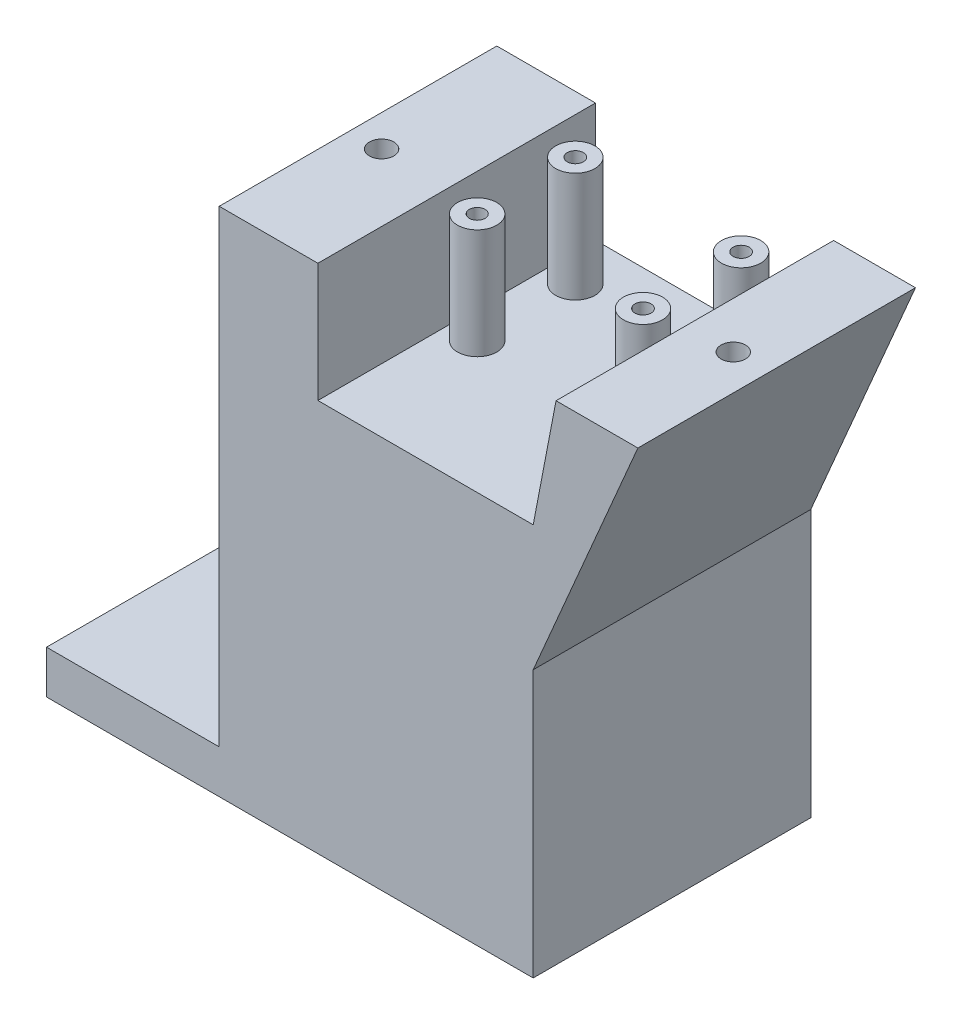
from build123d import *

# Parameters (mm, degrees)
SKETCH1_W              = 40
SKETCH1_H              = 35.362964007
BOSS_EXTRUDE1_DEPTH    = 50
SKETCH2_W              = 35.362964007
SKETCH2_H              = 5.5
BOSS_EXTRUDE2_DEPTH    = 22
SKETCH3_R              = 2.5
SKETCH3_R_2            = 1
SKETCH3_R_3            = 1.025
BOSS_EXTRUDE3_DEPTH    = 14
D_GAGEMENT_M71_D       = 8
BOSS_EXTRUDE4_DEPTH    = 35.362964
SKETCH8_W              = 12.572018863
SKETCH8_H              = 35.362964007
BOSS_EXTRUDE5_DEPTH    = 15.144107649
D_GAGEMENT_M2_53_D     = 3.1
D_GAGEMENT_M2_53_DEPTH = 6
D_GAGEMENT_M2_53_TIP   = 0.931333959
D_GAGEMENT_M2_51_D     = 3.1
D_GAGEMENT_M2_51_DEPTH = 6
D_GAGEMENT_M2_51_TIP   = 0.931333959


with BuildPart() as part:
    # Sketch1 → Boss-Extrude1 (new body)
    with BuildSketch(Plane(origin=(0, 0, 0), x_dir=(1, 0, 0), z_dir=(0, 1, 0))):
        with Locations((7.230679314, -2.945715381)):
            Rectangle(SKETCH1_W, SKETCH1_H)
    extrude(amount=BOSS_EXTRUDE1_DEPTH)

    # Sketch2 → Boss-Extrude2 (add)
    with BuildSketch(Plane.ZY.offset(12.769320686)):
        with Locations((2.945715381, 2.75)):
            Rectangle(SKETCH2_W, SKETCH2_H)
    extrude(amount=BOSS_EXTRUDE2_DEPTH)

    # Sketch3 → Boss-Extrude3 (add)
    # profile 1 of 4: a face of its own
    with BuildSketch(Plane(origin=(0, 50, 0), x_dir=(1, 0, 0), z_dir=(0, 1, 0))):
        with Locations(Location((3.355679314, -3.889233377, 0), (0, 0, 90))):
            Circle(SKETCH3_R)
        with Locations(Location((3.355679314, -3.889233377, 0), (0, 0, 270))):
            Circle(SKETCH3_R_2, mode=Mode.SUBTRACT)
    # profile 2 of 4: a face of its own
    with BuildSketch(Plane(origin=(0, 50, 0), x_dir=(1, 0, 0), z_dir=(0, 1, 0))):
        with Locations(Location((24.355679314, -3.764233372, 0), (0, 0, 90))):
            Circle(SKETCH3_R)
        with Locations(Location((24.355679314, -3.764233372, 0), (0, 0, 270))):
            Circle(SKETCH3_R_3, mode=Mode.SUBTRACT)
    # profile 3 of 4: a face of its own
    with BuildSketch(Plane(origin=(0, 50, 0), x_dir=(1, 0, 0), z_dir=(0, 1, 0))):
        with Locations(Location((3.355679314, 8.610766623, 0), (0, 0, 90))):
            Circle(SKETCH3_R)
        with Locations(Location((3.355679314, 8.610766623, 0), (0, 0, 270))):
            Circle(SKETCH3_R_3, mode=Mode.SUBTRACT)
    # profile 4 of 4: a face of its own
    with BuildSketch(Plane(origin=(0, 50, 0), x_dir=(1, 0, 0), z_dir=(0, 1, 0))):
        with Locations(Location((24.355307287, 8.735766623, 0), (0, 0, 90))):
            Circle(SKETCH3_R)
        with Locations(Location((24.355307287, 8.735766623, 0), (0, 0, 270))):
            Circle(SKETCH3_R_3, mode=Mode.SUBTRACT)
    extrude(amount=BOSS_EXTRUDE3_DEPTH)

    # Dégagement M71 (through all)
    with Locations(Plane(origin=(0, 0, 0), x_dir=(-1, 0, 0), z_dir=(0, -1, 0))):
        with Locations((24.769320686, -2.945715381)):
            Hole(D_GAGEMENT_M71_D / 2)

    # Sketch7 → Boss-Extrude4 (add)
    with BuildSketch(Plane.XY.offset(20.627197384)):
        Polygon((27.230679314, 34.010518151), (40.568594836, 65.144107649), (30.139889808, 65.144107649), (27.230679314, 50), align=None)
    extrude(amount=-BOSS_EXTRUDE4_DEPTH)

    # Sketch8 → Boss-Extrude5 (add)
    with BuildSketch(Plane(origin=(0, 50, 0), x_dir=(1, 0, 0), z_dir=(0, 1, 0))):
        with Locations((-6.483311255, -2.945715381)):
            Rectangle(SKETCH8_W, SKETCH8_H)
    extrude(amount=BOSS_EXTRUDE5_DEPTH)

    # Dégagement M2.53
    with Locations(Plane(origin=(0, 65.144107649, 0), x_dir=(1, 0, 0), z_dir=(0, 1, 0))):
        with Locations((-8.745252094, -3.961262734), (36.054747906, -3.961262734)):
            Hole(D_GAGEMENT_M2_53_D / 2, depth=D_GAGEMENT_M2_53_DEPTH)
            with Locations((0, 0, -(D_GAGEMENT_M2_53_DEPTH + D_GAGEMENT_M2_53_TIP / 2))):  # 118° drill point
                Cone(0, D_GAGEMENT_M2_53_D / 2, D_GAGEMENT_M2_53_TIP, mode=Mode.SUBTRACT)

    # Dégagement M2.51
    with Locations(Plane(origin=(0, 0, 0), x_dir=(-1, 0, 0), z_dir=(0, -1, 0))):
        with Locations((8.473719715, -2.945715381), (-20.230679314, -2.945715381)):
            Hole(D_GAGEMENT_M2_51_D / 2, depth=D_GAGEMENT_M2_51_DEPTH)
            with Locations((0, 0, -(D_GAGEMENT_M2_51_DEPTH + D_GAGEMENT_M2_51_TIP / 2))):  # 118° drill point
                Cone(0, D_GAGEMENT_M2_51_D / 2, D_GAGEMENT_M2_51_TIP, mode=Mode.SUBTRACT)


solid = part.part
